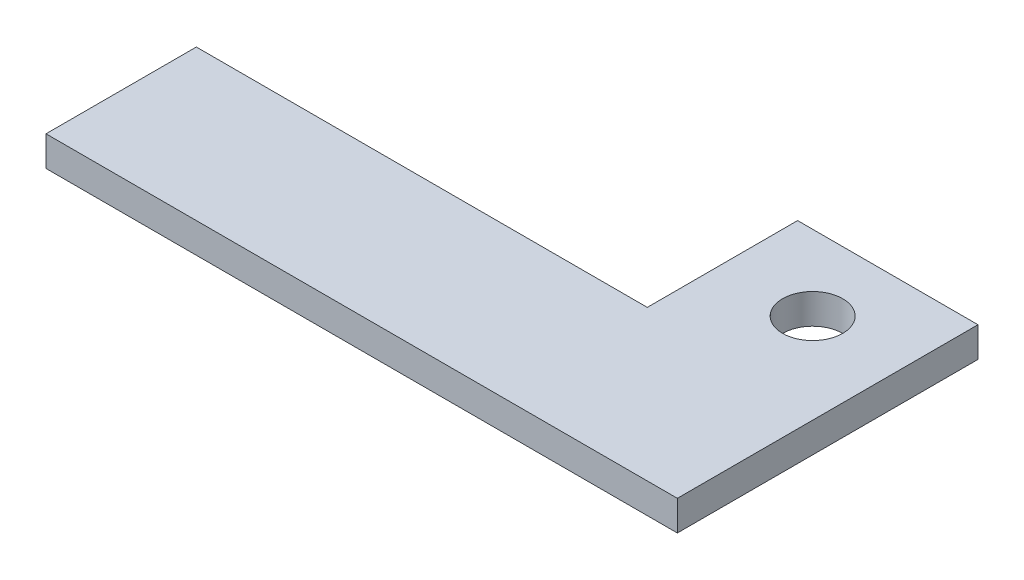
from build123d import *

# Parameters (mm, degrees)
SKETCH1_R           = 2
BOSS_EXTRUDE1_DEPTH = 2


with BuildPart() as part:
    # Sketch1 → Boss-Extrude1 (new body)
    with BuildSketch(Plane(origin=(0, 0, 0), x_dir=(1, 0, 0), z_dir=(0, 1, 0))):
        Polygon((0, 0), (-42, 0), (-42, 10), (-12, 10), (-12, 20), (0, 20), align=None)
        with Locations(Location((-6, 15, 0), (0, 0, 270))):
            Circle(SKETCH1_R, mode=Mode.SUBTRACT)
    extrude(amount=BOSS_EXTRUDE1_DEPTH)


solid = part.part
